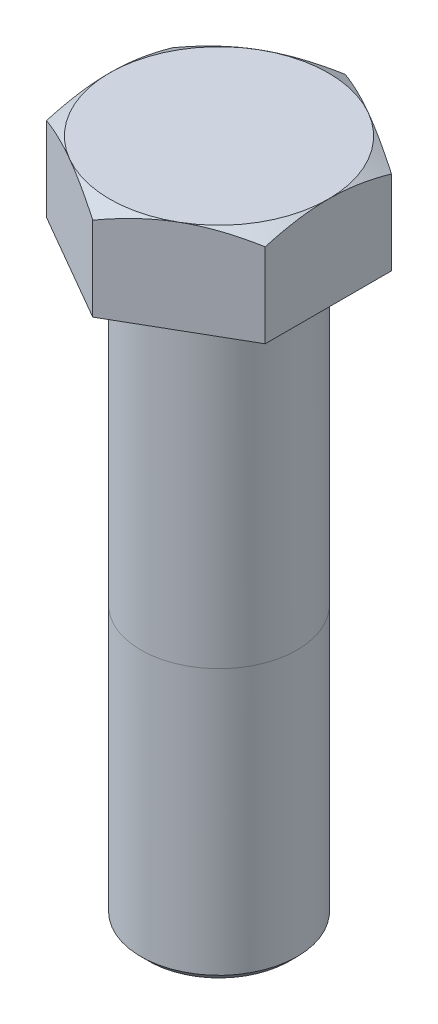
from build123d import *

# Parameters (mm, degrees)
BOSS_EXTRUDE1_DEPTH = 12
SKETCH2_OUTSIDE_W   = 80.454
SKETCH2_OUTSIDE_H   = 84.786
SKETCH2_OUTSIDE_R   = 14
CUT_EXTRUDE1_DEPTH  = 12
CUT_EXTRUDE1_DRAFT  = -60
SKETCH3_R           = 10
BOSS_EXTRUDE2_DEPTH = 75
CHAMFER1_SIZE       = 1


with BuildPart() as part:
    # Sketch1 → Boss-Extrude1 (new body)
    with BuildSketch(Plane(origin=(0, 0, 0), x_dir=(1, 0, 0), z_dir=(0, 1, 0))):
        Polygon((0, 16.165807537), (-14, 8.082903769), (-14, -8.082903769), (0, -16.165807537), (14, -8.082903769), (14, 8.082903769), align=None)
    extrude(amount=BOSS_EXTRUDE1_DEPTH)


with BuildPart() as cut_extrude1_tool:
    # Sketch2 outside → Cut-Extrude1 (with draft: the straight prism first)
    with BuildSketch(Plane(origin=(0, 12, 0), x_dir=(1, 0, 0), z_dir=(0, 1, 0))):
        Rectangle(SKETCH2_OUTSIDE_W, SKETCH2_OUTSIDE_H)
        Circle(SKETCH2_OUTSIDE_R, mode=Mode.SUBTRACT)
    extrude(amount=-CUT_EXTRUDE1_DEPTH)
    # Cut-Extrude1: the draft: its side faces are tilted about the plane it starts from
    cut_extrude1_sides = [cut_extrude1_tool.faces().sort_by_distance(p)[0] for p in [
        (0, 6, 42.393),
        (40.227, 6, 0),
        (0, 6, -42.393),
        (-40.227, 6, 0),
        (-14, 6, 0),
    ]]
    draft(cut_extrude1_sides, Plane(origin=(0, 12, 0), x_dir=(1, 0, 0), z_dir=(0, 1, 0)), CUT_EXTRUDE1_DRAFT)


with BuildPart() as part_1:
    add(part.part)

    # Cut-Extrude1: cut by cut_extrude1_tool
    add(cut_extrude1_tool.part, mode=Mode.SUBTRACT)

    # Sketch3 → Boss-Extrude2 (add)
    with BuildSketch(Plane.XZ):
        with Locations(Location((0, 0, 0), (0, 0, 90))):
            Circle(SKETCH3_R)
    extrude(amount=BOSS_EXTRUDE2_DEPTH)

    # Chamfer1
    chamfer1_edges = [part_1.edges().sort_by_distance(p)[0] for p in [
        (0, -75, -10),
    ]]
    chamfer(chamfer1_edges, length=CHAMFER1_SIZE)


solid = part_1.part
